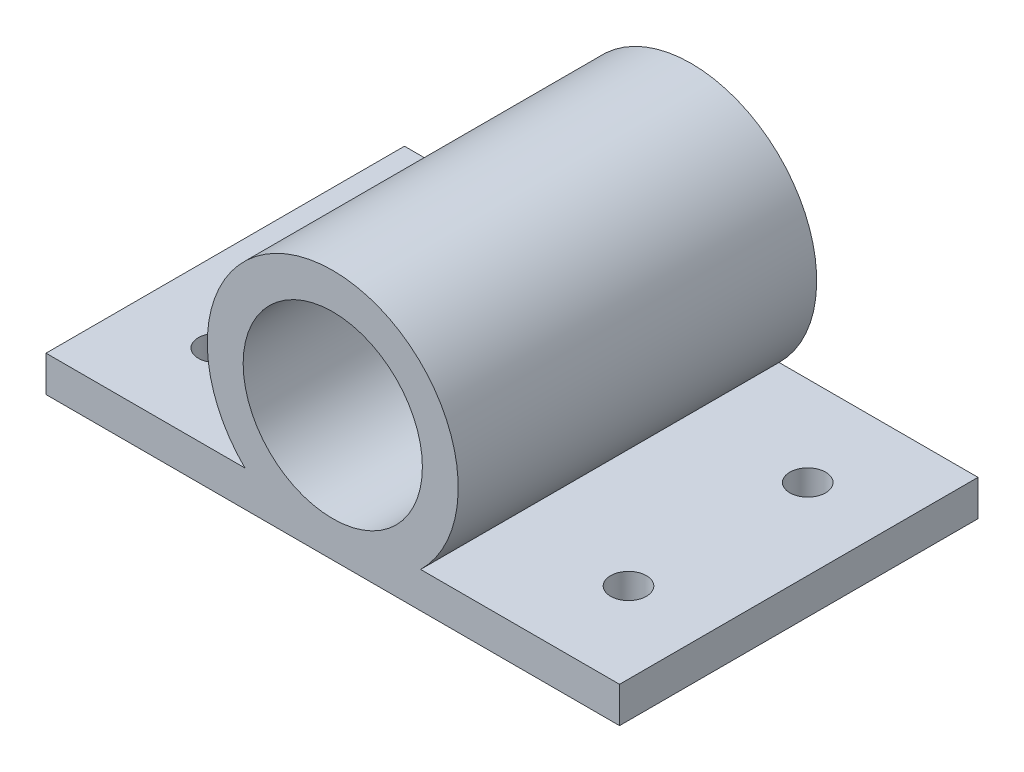
from build123d import *

# Parameters (mm, degrees)
SKETCH2_R           = 25
BOSS_EXTRUDE1_DEPTH = 100
SKETCH3_R           = 5
CUT_EXTRUDE1_DEPTH  = 10


with BuildPart() as part:
    # Sketch2 → Boss-Extrude1 (new body)
    with BuildSketch(Plane.XY):
        with BuildLine():
            Line((-80, -35), (80, -35))
            Line((80, -35), (80, -25))
            Line((80, -25), (24.494897428, -25))
            ThreePointArc((24.494897428, -25), (0, 35), (-24.494897428, -25))
            Line((-24.494897428, -25), (-80, -25))
            Line((-80, -25), (-80, -35))
        make_face()
        Circle(SKETCH2_R, mode=Mode.SUBTRACT)
    extrude(amount=BOSS_EXTRUDE1_DEPTH)

    # Sketch3 → Cut-Extrude1 (cut)
    with BuildSketch(Plane(origin=(0, -25, 0), x_dir=(1, 0, 0), z_dir=(0, 1, 0))):
        with Locations(Location((57.5, -25, 0), (0, 0, 180))):
            Circle(SKETCH3_R)
        with Locations(Location((57.5, -75, 0), (0, 0, 180))):
            Circle(SKETCH3_R)
        with Locations(Location((-57.5, -25, 0), (0, 0, 180))):
            Circle(SKETCH3_R)
        with Locations(Location((-57.5, -75, 0), (0, 0, 180))):
            Circle(SKETCH3_R)
    extrude(amount=-CUT_EXTRUDE1_DEPTH, mode=Mode.SUBTRACT)


solid = part.part
